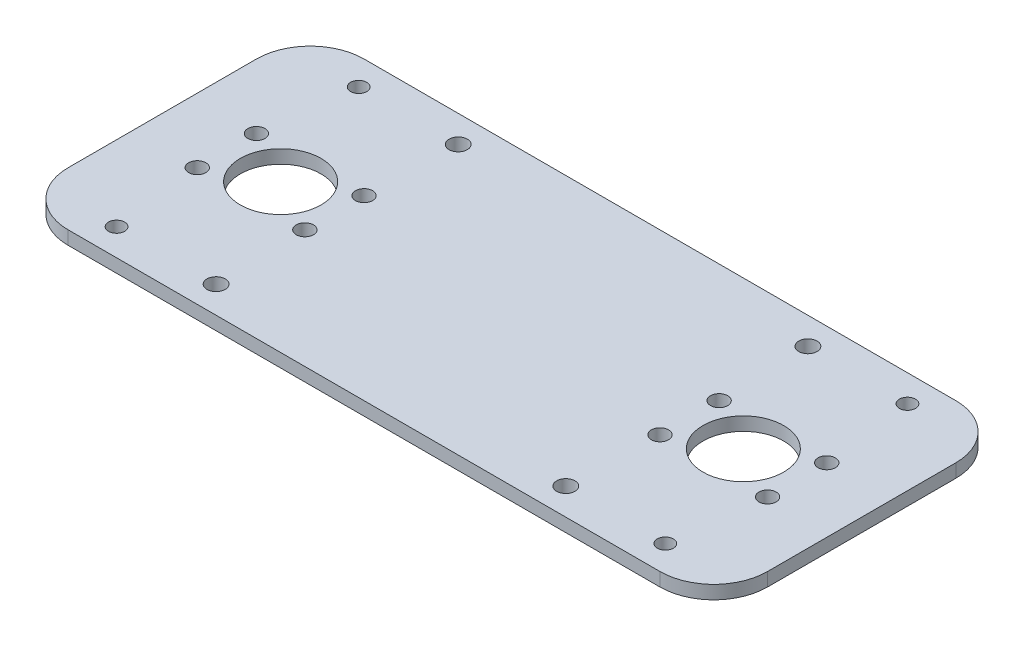
from build123d import *

# Parameters (mm, degrees)
BOSS_EXTRUDE1_DEPTH = 2.5
SKETCH2_R           = 1.5
CUT_EXTRUDE1_DEPTH  = 142.178079035
SKETCH3_R           = 1.6
CUT_EXTRUDE2_DEPTH  = 10
SKETCH4_R           = 1.6
CUT_EXTRUDE3_DEPTH  = 10
SKETCH5_R           = 1.6
CUT_EXTRUDE4_DEPTH  = 10
SKETCH8_R           = 1.6
CUT_EXTRUDE5_DEPTH  = 10
SKETCH9_R           = 1.7
CUT_EXTRUDE6_DEPTH  = 10
SKETCH10_R          = 7.5
CUT_EXTRUDE7_DEPTH  = 10


with BuildPart() as part:
    # Sketch1 → Boss-Extrude1 (new body)
    with BuildSketch(Plane(origin=(0, 0, 0), x_dir=(1, 0, 0), z_dir=(0, 1, 0))):
        with BuildLine():
            Line((10, 0), (120, 0))
            ThreePointArc((120, 0), (127.071067812, 2.928932188), (130, 10))
            Line((130, 10), (130, 45))
            ThreePointArc((130, 45), (127.071067812, 52.071067812), (120, 55))
            Line((120, 55), (10, 55))
            ThreePointArc((10, 55), (2.928932188, 52.071067812), (0, 45))
            Line((0, 45), (0, 10))
            ThreePointArc((0, 10), (2.928932188, 2.928932188), (10, 0))
        make_face()
    extrude(amount=BOSS_EXTRUDE1_DEPTH)

    # Sketch2 → Cut-Extrude1 (cut, through all)
    with BuildSketch(Plane(origin=(0, 2.5, 0), x_dir=(1, 0, 0), z_dir=(0, 1, 0))):
        with Locations((14, 5)):
            Circle(SKETCH2_R)
        with Locations((14, 50)):
            Circle(SKETCH2_R)
        with Locations((116, 5)):
            Circle(SKETCH2_R)
        with Locations((116, 50)):
            Circle(SKETCH2_R)
    extrude(amount=-CUT_EXTRUDE1_DEPTH, mode=Mode.SUBTRACT)

    # Sketch3 → Cut-Extrude2 (cut)
    with BuildSketch(Plane(origin=(0, 2.5, 0), x_dir=(1, 0, 0), z_dir=(0, 1, 0))):
        with Locations((12, 33)):
            Circle(SKETCH3_R)
    extrude(amount=-CUT_EXTRUDE2_DEPTH, mode=Mode.SUBTRACT)

    # Sketch4 → Cut-Extrude3 (cut)
    with BuildSketch(Plane(origin=(0, 2.5, 0), x_dir=(1, 0, 0), z_dir=(0, 1, 0))):
        with Locations((12, 22)):
            Circle(SKETCH4_R)
    extrude(amount=-CUT_EXTRUDE3_DEPTH, mode=Mode.SUBTRACT)

    # Sketch5 → Cut-Extrude4 (cut)
    with BuildSketch(Plane(origin=(0, 2.5, 0), x_dir=(1, 0, 0), z_dir=(0, 1, 0))):
        with Locations((32, 33)):
            Circle(SKETCH5_R)
        with Locations((32, 22)):
            Circle(SKETCH5_R)
    extrude(amount=-CUT_EXTRUDE4_DEPTH, mode=Mode.SUBTRACT)

    # Sketch8 → Cut-Extrude5 (cut)
    with BuildSketch(Plane(origin=(0, 2.5, 0), x_dir=(1, 0, 0), z_dir=(0, 1, 0))):
        with Locations((98, 33)):
            Circle(SKETCH8_R)
        with Locations((98, 22)):
            Circle(SKETCH8_R)
        with Locations((118, 33)):
            Circle(SKETCH8_R)
        with Locations((118, 22)):
            Circle(SKETCH8_R)
    extrude(amount=-CUT_EXTRUDE5_DEPTH, mode=Mode.SUBTRACT)

    # Sketch9 → Cut-Extrude6 (cut)
    with BuildSketch(Plane(origin=(0, 2.5, 0), x_dir=(1, 0, 0), z_dir=(0, 1, 0))):
        with Locations((32.5, 50)):
            Circle(SKETCH9_R)
        with Locations((97.5, 50)):
            Circle(SKETCH9_R)
        with Locations((97.5, 5)):
            Circle(SKETCH9_R)
        with Locations((32.5, 5)):
            Circle(SKETCH9_R)
    extrude(amount=-CUT_EXTRUDE6_DEPTH, mode=Mode.SUBTRACT)

    # Sketch10 → Cut-Extrude7 (cut)
    with BuildSketch(Plane.XZ):
        with Locations((22, -27.5)):
            Circle(SKETCH10_R)
        with Locations((108, -27.5)):
            Circle(SKETCH10_R)
    extrude(amount=-CUT_EXTRUDE7_DEPTH, mode=Mode.SUBTRACT)


solid = part.part
